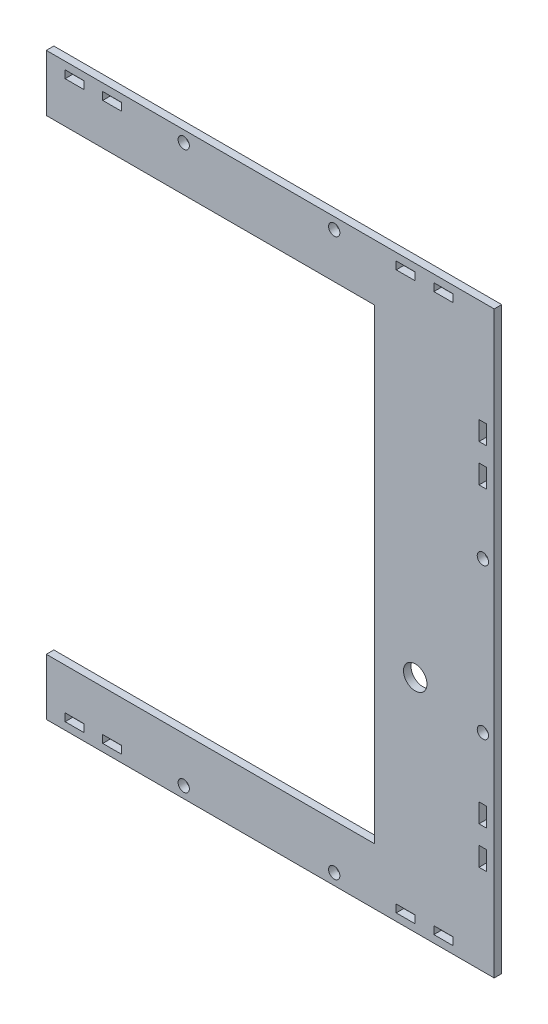
from build123d import *

# Parameters (mm, degrees)
SKETCH_1_R      = 1.5
SKETCH_1_R_2    = 3.121318996
SKETCH_1_W      = 5.05
SKETCH_1_H      = 2.05
SKETCH_1_W_2    = 2.05
SKETCH_1_H_2    = 5.05
EXTRUDE_1_DEPTH = 2


with BuildPart() as part:
    # 草图1 → 凸台-拉伸1 (new body)
    with BuildSketch(Plane.XY):
        Polygon((-56.111334712, -13.372248853), (31.071025228, -13.372248853), (31.071025228, -137.372248853), (-56.111334712, -137.372248853), (-56.111334712, -152.372248853), (62.919821756, -152.372248853), (62.919821756, 1.627751147), (-56.111334712, 1.627751147), align=None)
        with Locations((-19.586334712, -1.372248853)):
            Circle(SKETCH_1_R, mode=Mode.SUBTRACT)
        with Locations((20.413665288, -1.372248853)):
            Circle(SKETCH_1_R, mode=Mode.SUBTRACT)
        with Locations((-19.586334712, -149.372248853)):
            Circle(SKETCH_1_R, mode=Mode.SUBTRACT)
        with Locations((20.413665288, -149.372248853)):
            Circle(SKETCH_1_R, mode=Mode.SUBTRACT)
        with Locations((59.919821756, -97.372248853)):
            Circle(SKETCH_1_R, mode=Mode.SUBTRACT)
        with Locations((59.919821756, -57.372248853)):
            Circle(SKETCH_1_R, mode=Mode.SUBTRACT)
        with Locations((41.938665288, -93.678088908)):
            Circle(SKETCH_1_R_2, mode=Mode.SUBTRACT)
        with Locations((39.413665288, -1.372248853)):
            Rectangle(SKETCH_1_W, SKETCH_1_H, mode=Mode.SUBTRACT)
        with Locations((49.413665288, -1.372248853)):
            Rectangle(SKETCH_1_W, SKETCH_1_H, mode=Mode.SUBTRACT)
        with Locations((-48.586334712, -1.372248853)):
            Rectangle(SKETCH_1_W, SKETCH_1_H, mode=Mode.SUBTRACT)
        with Locations((-38.586334712, -1.372248853)):
            Rectangle(SKETCH_1_W, SKETCH_1_H, mode=Mode.SUBTRACT)
        with Locations((39.413665288, -149.372248853)):
            Rectangle(SKETCH_1_W, SKETCH_1_H, mode=Mode.SUBTRACT)
        with Locations((49.413665288, -149.372248853)):
            Rectangle(SKETCH_1_W, SKETCH_1_H, mode=Mode.SUBTRACT)
        with Locations((-48.586334712, -149.372248853)):
            Rectangle(SKETCH_1_W, SKETCH_1_H, mode=Mode.SUBTRACT)
        with Locations((-38.586334712, -149.372248853)):
            Rectangle(SKETCH_1_W, SKETCH_1_H, mode=Mode.SUBTRACT)
        with Locations((59.919821756, -38.372248853)):
            Rectangle(SKETCH_1_W_2, SKETCH_1_H_2, mode=Mode.SUBTRACT)
        with Locations((59.919821756, -28.372248853)):
            Rectangle(SKETCH_1_W_2, SKETCH_1_H_2, mode=Mode.SUBTRACT)
        with Locations((59.919821756, -126.372248853)):
            Rectangle(SKETCH_1_W_2, SKETCH_1_H_2, mode=Mode.SUBTRACT)
        with Locations((59.919821756, -116.372248853)):
            Rectangle(SKETCH_1_W_2, SKETCH_1_H_2, mode=Mode.SUBTRACT)
    extrude(amount=EXTRUDE_1_DEPTH)


solid = part.part
